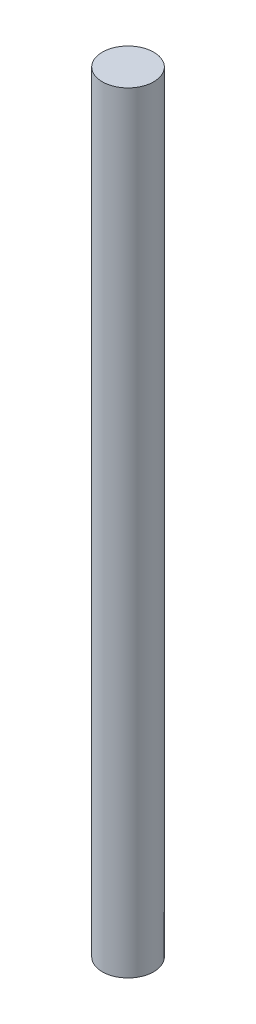
from build123d import *

# Parameters (mm, degrees)
SKETCH2_R           = 1.5
BOSS_EXTRUDE1_DEPTH = 22.5


with BuildPart() as part:
    # Sketch2 → Boss-Extrude1 (new, symmetric)
    with BuildSketch(Plane(origin=(0, 0, 0), x_dir=(1, 0, 0), z_dir=(0, 1, 0))):
        with Locations(Location((0, 0, 0), (0, 0, 90))):
            Circle(SKETCH2_R)
    extrude(amount=BOSS_EXTRUDE1_DEPTH, both=True)


solid = part.part
